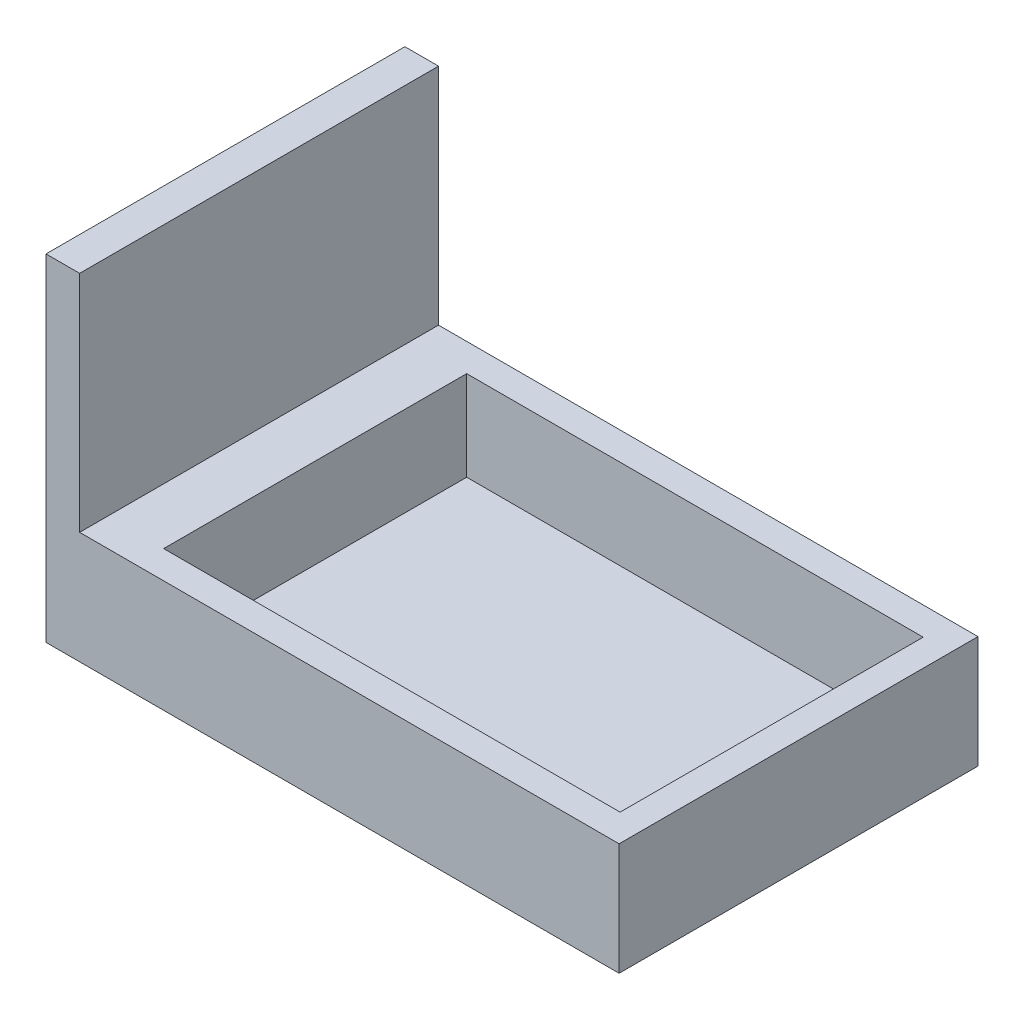
from build123d import *

# Parameters (mm, degrees)
SKETCH1_W           = 45.5
SKETCH1_H           = 32
BOSS_EXTRUDE1_DEPTH = 10
SKETCH2_W           = 40.7
SKETCH2_H           = 27.02
CUT_EXTRUDE1_DEPTH  = 8
SKETCH3_W           = 32
SKETCH3_H           = 10
BOSS_EXTRUDE2_DEPTH = 5.6
SKETCH4_W           = 3
SKETCH4_H           = 32
BOSS_EXTRUDE3_DEPTH = 20


with BuildPart() as part:
    # Sketch1 → Boss-Extrude1 (new body)
    with BuildSketch(Plane(origin=(0, 0, 0), x_dir=(1, 0, 0), z_dir=(0, 1, 0))):
        with Locations((22.75, 16)):
            Rectangle(SKETCH1_W, SKETCH1_H)
    extrude(amount=BOSS_EXTRUDE1_DEPTH)

    # Sketch2 → Cut-Extrude1 (cut)
    with BuildSketch(Plane(origin=(0, 10, 0), x_dir=(1, 0, 0), z_dir=(0, 1, 0))):
        with Locations((22.749993038, 16.000024748)):
            Rectangle(SKETCH2_W, SKETCH2_H)
    extrude(amount=-CUT_EXTRUDE1_DEPTH, mode=Mode.SUBTRACT)

    # Sketch3 → Boss-Extrude2 (add)
    with BuildSketch(Plane.ZY):
        with Locations((-16, 5)):
            Rectangle(SKETCH3_W, SKETCH3_H)
    extrude(amount=BOSS_EXTRUDE2_DEPTH)

    # Sketch4 → Boss-Extrude3 (add)
    with BuildSketch(Plane(origin=(0, 10, 0), x_dir=(1, 0, 0), z_dir=(0, 1, 0))):
        with Locations((-4.1, 16)):
            Rectangle(SKETCH4_W, SKETCH4_H)
    extrude(amount=BOSS_EXTRUDE3_DEPTH)


solid = part.part
